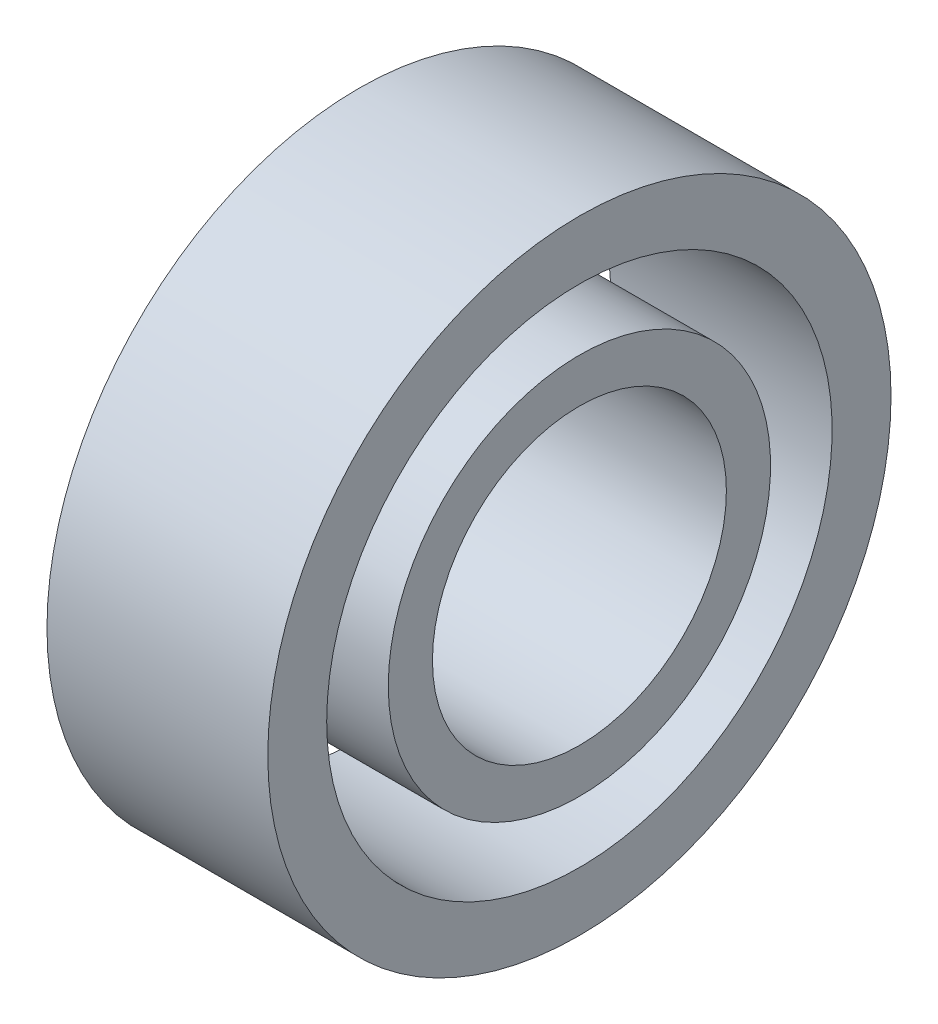
from build123d import *

# Parameters (mm, degrees)
SKETCH2_W   = 4.5
SKETCH2_H   = 1.2
SKETCH2_H_2 = 0.9


with BuildPart() as part:
    # Sketch2 → Revolve1 (revolve)
    with BuildSketch(Plane.XY, mode=Mode.PRIVATE) as revolve1_sk:
        with Locations((0, 5.75)):
            Rectangle(SKETCH2_W, SKETCH2_H)
        with Locations((0, 3.445)):
            Rectangle(SKETCH2_W, SKETCH2_H_2)
    revolve(revolve1_sk.sketch.rotate(Axis((-11.720930233, 0, 0), (1, 0, 0)), 90), axis=Axis((-11.720930233, 0, 0), (1, 0, 0)))


solid = part.part
